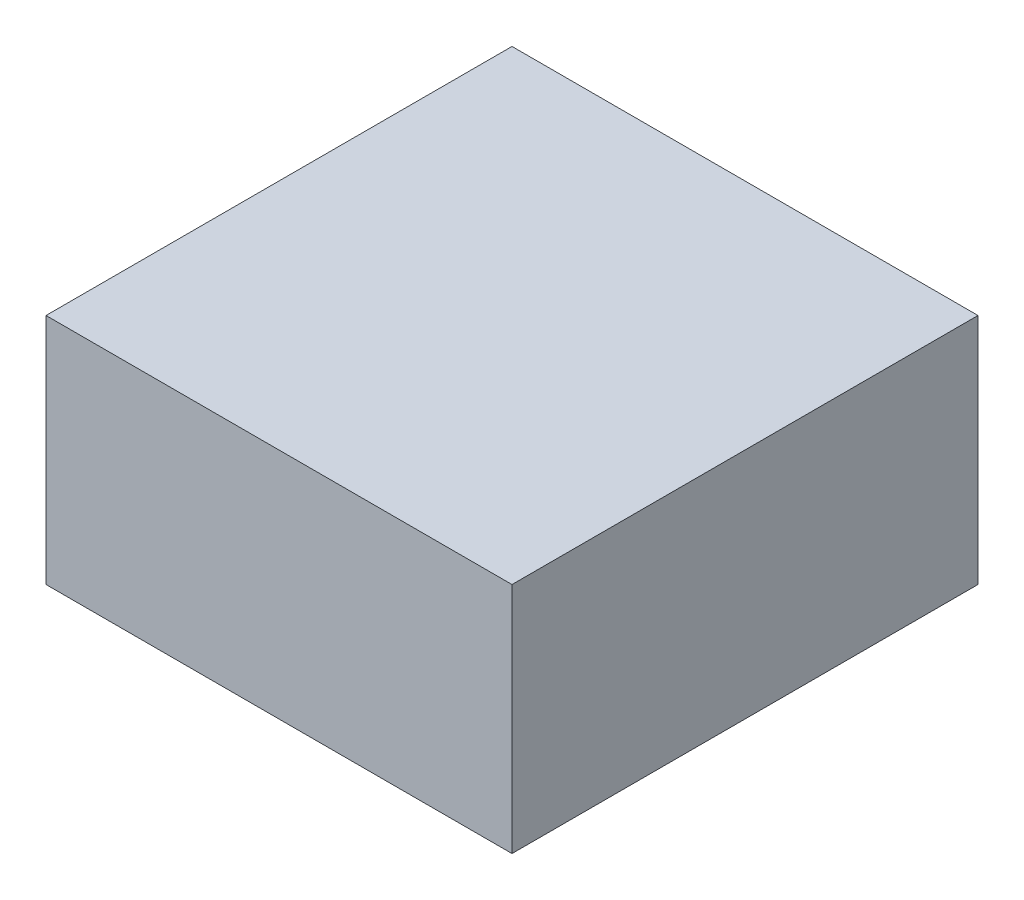
from build123d import *

# Parameters (mm, degrees)
SKETCH1_W           = 40
SKETCH1_H           = 40
BOSS_EXTRUDE1_DEPTH = 20


with BuildPart() as part:
    # Sketch1 → Boss-Extrude1 (new body)
    with BuildSketch(Plane(origin=(0, 0, 0), x_dir=(1, 0, 0), z_dir=(0, 1, 0))):
        with Locations((25.434088183, 60.911940992)):
            Rectangle(SKETCH1_W, SKETCH1_H)
    extrude(amount=BOSS_EXTRUDE1_DEPTH)


solid = part.part
